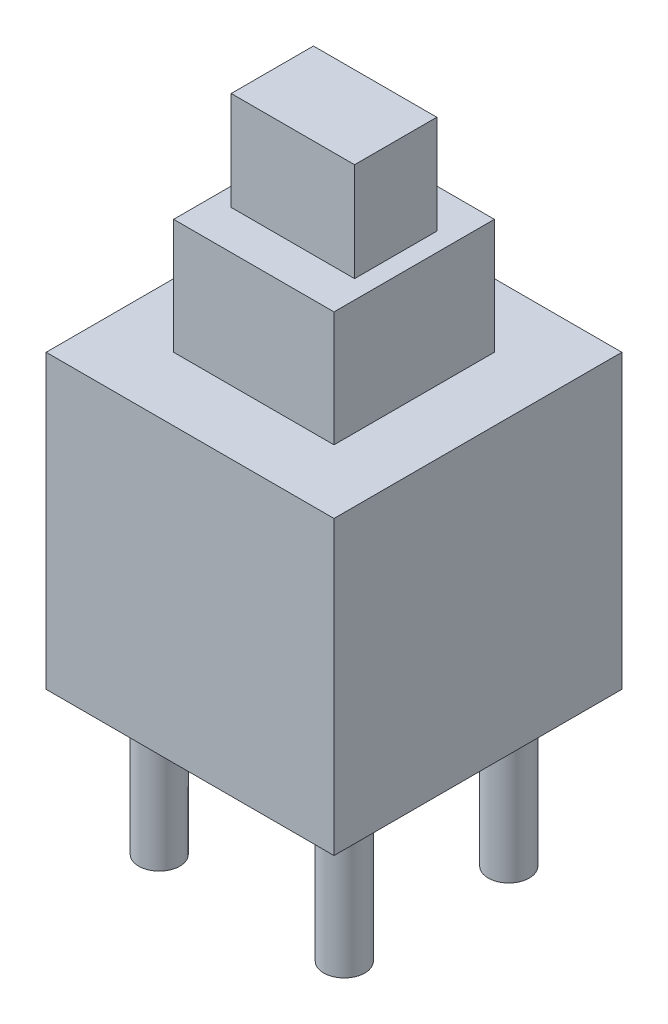
from build123d import *

# Parameters (mm, degrees)
SKETCH_1_W      = 7
SKETCH_1_H      = 7
EXTRUDE_1_DEPTH = 7.1
SKETCH_2_W      = 3.9
SKETCH_2_H      = 3.9
EXTRUDE_2_DEPTH = 2.8
SKETCH_3_R      = 0.5
EXTRUDE_3_DEPTH = 3.6
SKETCH_4_W      = 3
SKETCH_4_H      = 2
EXTRUDE_4_DEPTH = 2.4


with BuildPart() as part:
    # 草图1 → 凸台-拉伸1 (new body)
    with BuildSketch(Plane(origin=(0, 0, 0), x_dir=(1, 0, 0), z_dir=(0, 1, 0))):
        with Locations((3.5, 3.5)):
            Rectangle(SKETCH_1_W, SKETCH_1_H)
    extrude(amount=EXTRUDE_1_DEPTH)

    # 草图2 → 凸台-拉伸2 (add)
    with BuildSketch(Plane(origin=(0, 7.1, 0), x_dir=(1, 0, 0), z_dir=(0, 1, 0))):
        with Locations((3.5, 3.5)):
            Rectangle(SKETCH_2_W, SKETCH_2_H)
    extrude(amount=EXTRUDE_2_DEPTH)

    # 草图3 → 凸台-拉伸3 (add)
    with BuildSketch(Plane.XZ):
        with Locations(Location((1.25, -1.5, 0), (0, 0, 270))):
            Circle(SKETCH_3_R)
        with Locations(Location((5.75, -1.5, 0), (0, 0, 270))):
            Circle(SKETCH_3_R)
        with Locations(Location((5.75, -5.5, 0), (0, 0, 270))):
            Circle(SKETCH_3_R)
        with Locations(Location((1.25, -5.5, 0), (0, 0, 270))):
            Circle(SKETCH_3_R)
    extrude(amount=EXTRUDE_3_DEPTH)

    # 草图4 → 凸台-拉伸4 (add)
    with BuildSketch(Plane(origin=(0, 9.9, 0), x_dir=(1, 0, 0), z_dir=(0, 1, 0))):
        with Locations((3.5, 3.5)):
            Rectangle(SKETCH_4_W, SKETCH_4_H)
    extrude(amount=EXTRUDE_4_DEPTH)


solid = part.part
